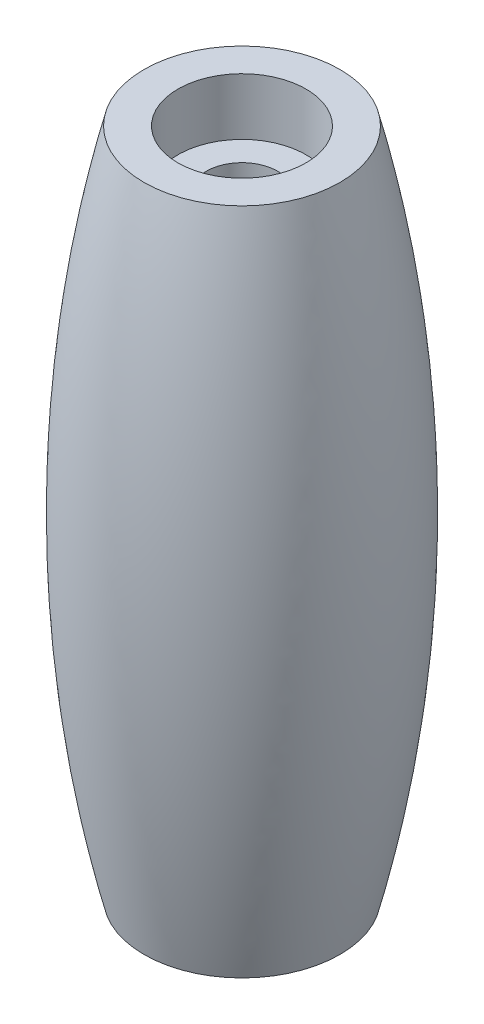
from build123d import *

# Parameters (mm, degrees)
SKETCH_2_R           = 4.5
CUT_EXTRUDE_1_DEPTH  = 49.970922631
EXTRUDE_1_DEPTH      = 19.5
EXTRUDE_1_DEPTH_BACK = 19.5
SKETCH_3_R           = 4.5
SKETCH_3_R_2         = 2.5


with BuildPart() as part:
    # ｽｹｯﾁ1 → 回転1 (revolve)
    with BuildSketch(Plane.XY):
        with BuildLine():
            Line((0, 23.5), (6.882979176, 23.5))
            add(Edge.make_bspline(
                [(6.882979176, -23.5), (12.738297933, 0), (6.882979176, 23.5)],
                knots=[4.373605266, 4.373605266, 4.373605266, 5.051172695, 5.051172695, 5.051172695], degree=2, weights=[1, 0.943159584, 1]))
            Line((6.882979176, -23.5), (0, -23.5))
            Line((0, -23.5), (0, 23.5))
        make_face()
    revolve(axis=Axis((0, 0, 0), (0, 1, 0)))

    # ｽｹｯﾁ2 → ｶｯﾄ - 押し出し1 (cut, through all)
    with BuildSketch(Plane(origin=(0, 23.5, 0), x_dir=(1, 0, 0), z_dir=(0, 1, 0))):
        with Locations(Location((0, 0, 0), (0, 0, 270))):
            Circle(SKETCH_2_R)
    extrude(amount=-CUT_EXTRUDE_1_DEPTH, mode=Mode.SUBTRACT)

    # ｽｹｯﾁ3 → ﾎﾞｽ - 押し出し1 (add, two sides: drawn at the far end of the back side and taken through both)
    with BuildSketch(Plane(origin=(0, 0, 0), x_dir=(1, 0, 0), z_dir=(0, 1, 0)).offset(-EXTRUDE_1_DEPTH_BACK)):
        with Locations(Location((0, 0, 0), (0, 0, 270))):
            Circle(SKETCH_3_R)
        with Locations(Location((0, 0, 0), (0, 0, 270))):
            Circle(SKETCH_3_R_2, mode=Mode.SUBTRACT)
    extrude(amount=EXTRUDE_1_DEPTH + EXTRUDE_1_DEPTH_BACK)


solid = part.part
